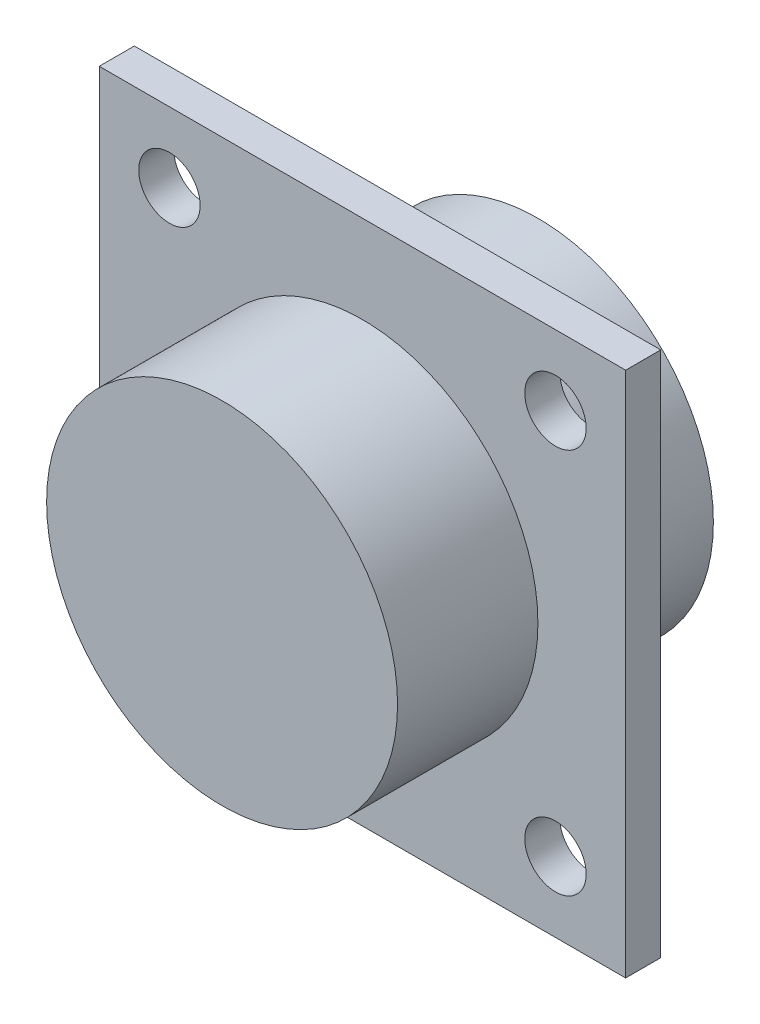
from build123d import *

# Parameters (mm, degrees)
SKETCH_1_W           = 30
SKETCH_1_H           = 30
EXTRUDE_1_DEPTH      = 2
EXTRUDE_2_DEPTH      = 8
EXTRUDE_2_DEPTH_BACK = 10
SKETCH_2_R           = 10
SKETCH_3_R           = 8.5
CUT_EXTRUDE_1_DEPTH  = 8
SKETCH_4_R           = 1.75
CUT_EXTRUDE_2_DEPTH  = 8


with BuildPart() as part:
    # 草图1 → 凸台-拉伸1 (new body)
    with BuildSketch(Plane.XY):
        Rectangle(SKETCH_1_W, SKETCH_1_H)
    extrude(amount=EXTRUDE_1_DEPTH)

    # 草图2 → 凸台-拉伸2 (add, two sides: drawn at the far end of the back side and taken through both)
    with BuildSketch(Plane.XY.offset(2).offset(-EXTRUDE_2_DEPTH_BACK)):
        Circle(SKETCH_2_R)
    extrude(amount=EXTRUDE_2_DEPTH + EXTRUDE_2_DEPTH_BACK)

    # 草图3 → 切除-拉伸1 (cut)
    with BuildSketch(Plane(origin=(0, 0, -8), x_dir=(-1, 0, 0), z_dir=(0, 0, -1))):
        Circle(SKETCH_3_R)
    extrude(amount=-CUT_EXTRUDE_1_DEPTH, mode=Mode.SUBTRACT)

    # 草图4 → 切除-拉伸2 (cut)
    with BuildSketch(Plane(origin=(0, 0, 0), x_dir=(-1, 0, 0), z_dir=(0, 0, -1))):
        with Locations((-11, 11)):
            Circle(SKETCH_4_R)
        with Locations(Location((11, 11, 0), (0, 0, 180))):
            Circle(SKETCH_4_R)
        with Locations((11, -11)):
            Circle(SKETCH_4_R)
        with Locations(Location((-11, -11, 0), (0, 0, 180))):
            Circle(SKETCH_4_R)
    extrude(amount=-CUT_EXTRUDE_2_DEPTH, mode=Mode.SUBTRACT)


solid = part.part
